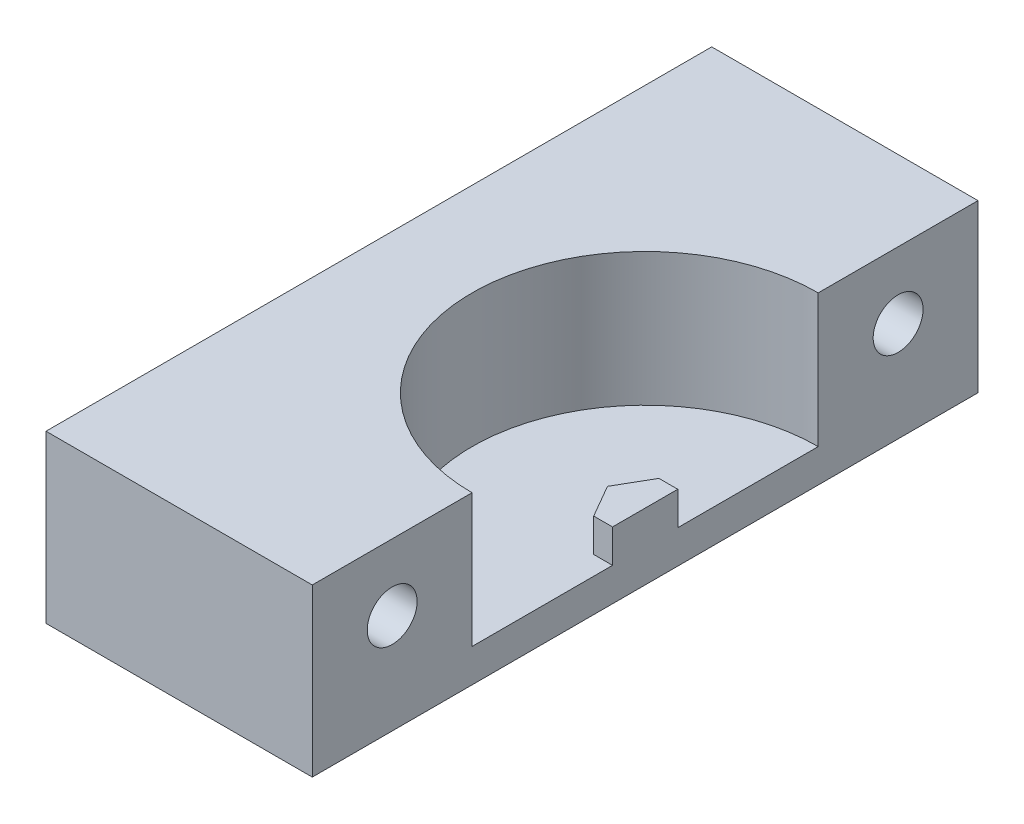
from build123d import *

# Parameters (mm, degrees)
BOSS_EXTRUDE1_DEPTH = 25.4
SKETCH2_W           = 50.8
SKETCH2_H           = 127
BOSS_EXTRUDE2_DEPTH = 6.35
SKETCH3_R           = 4.7625
CUT_EXTRUDE1_DEPTH  = 86.194189943
BOSS_EXTRUDE3_DEPTH = 6.35


with BuildPart() as part:
    # Sketch1 → Boss-Extrude1 (new body)
    with BuildSketch(Plane(origin=(0, 0, 0), x_dir=(1, 0, 0), z_dir=(0, 1, 0))):
        with BuildLine():
            Line((0, 33.02), (0, 63.5))
            Line((0, 63.5), (-50.8, 63.5))
            Line((-50.8, 63.5), (-50.8, -63.5))
            Line((-50.8, -63.5), (0, -63.5))
            Line((0, -63.5), (0, -33.02))
            ThreePointArc((0, -33.02), (-33.02, 0), (0, 33.02))
        make_face()
    extrude(amount=BOSS_EXTRUDE1_DEPTH)

    # Sketch2 → Boss-Extrude2 (add)
    with BuildSketch(Plane.XZ):
        with Locations((-25.4, 0)):
            Rectangle(SKETCH2_W, SKETCH2_H)
    extrude(amount=BOSS_EXTRUDE2_DEPTH)

    # Sketch3 → Cut-Extrude1 (cut, through all)
    with BuildSketch(Plane(origin=(0, 0, 0), x_dir=(0, 0, -1), z_dir=(1, 0, 0))):
        with Locations((-48.26, 12.7)):
            Circle(SKETCH3_R)
        with Locations(Location((48.26, 12.7, 0), (0, 0, 180))):
            Circle(SKETCH3_R)
    extrude(amount=-CUT_EXTRUDE1_DEPTH, mode=Mode.SUBTRACT)

    # Sketch4 → Boss-Extrude3 (add)
    with BuildSketch(Plane(origin=(0, 0, 0), x_dir=(1, 0, 0), z_dir=(0, 1, 0))):
        Polygon((-3.592850725, 6.223), (-7.18570145, 0), (-3.592850725, -6.223), (0, -6.223), (0, 6.223), align=None)
    extrude(amount=BOSS_EXTRUDE3_DEPTH)


solid = part.part
